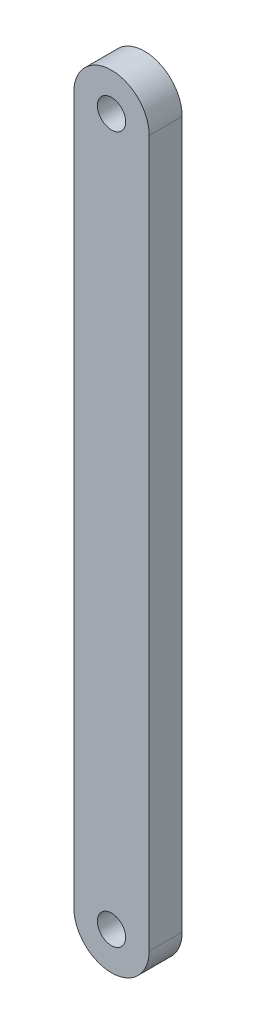
from build123d import *

# Parameters (mm, degrees)
SKETCH1_R           = 1.5
BOSS_EXTRUDE1_DEPTH = 3.5


with BuildPart() as part:
    # Sketch1 → Boss-Extrude1 (new body)
    with BuildSketch(Plane.XY):
        with BuildLine():
            Line((-4, 75), (-4, 0))
            ThreePointArc((-4, 0), (0, -4), (4, 0))
            Line((4, 0), (4, 75))
            ThreePointArc((4, 75), (0, 79), (-4, 75))
        make_face()
        with Locations((0, 75)):
            Circle(SKETCH1_R, mode=Mode.SUBTRACT)
        Circle(SKETCH1_R, mode=Mode.SUBTRACT)
    extrude(amount=BOSS_EXTRUDE1_DEPTH)


solid = part.part
